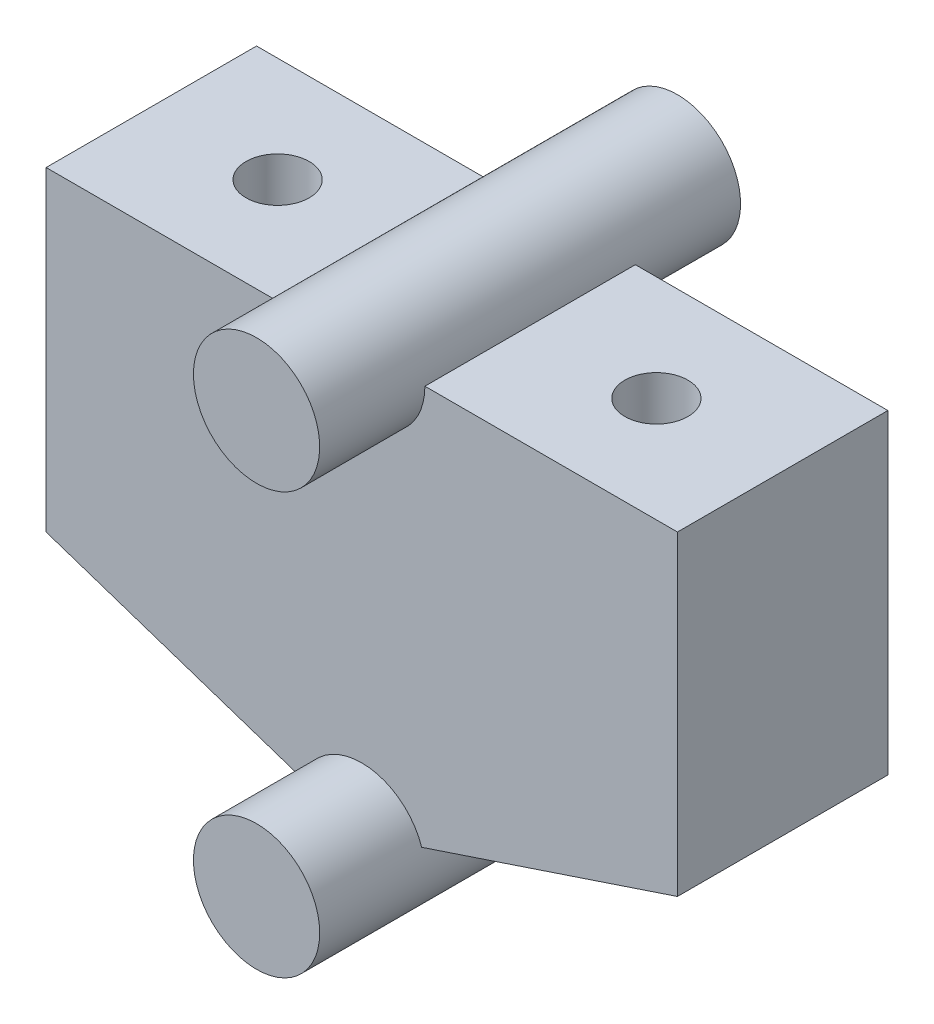
from build123d import *

# Parameters (mm, degrees)
BOSS_EXTRUDE1_DEPTH      = 10
BOSS_EXTRUDE2_DEPTH      = 15
BOSS_EXTRUDE2_DEPTH_BACK = 5
SKETCH2_R                = 1.5
CUT_EXTRUDE1_DEPTH       = 32.288975694
BOSS_EXTRUDE3_DEPTH      = 5
BOSS_EXTRUDE3_DEPTH_BACK = 15
SKETCH3_R                = 3


with BuildPart() as part:
    # Sketch1 → Boss-Extrude1 (new body)
    with BuildSketch(Plane.XY):
        with BuildLine():
            Line((-15, 7.5), (-15, -7.5))
            Line((-15, -7.5), (-2.846049894, -11.551316702))
            ThreePointArc((-2.846049894, -11.551316702), (0, -9.5), (2.846049894, -11.551316702))
            Line((2.846049894, -11.551316702), (15, -7.5))
            Line((15, -7.5), (15, 7.5))
            Line((15, 7.5), (-15, 7.5))
        make_face()
    extrude(amount=BOSS_EXTRUDE1_DEPTH)

    # Sketch1<3> → Boss-Extrude2 (add, two sides: drawn at the far end of the back side and taken through both)
    with BuildSketch(Plane.XY.offset(-BOSS_EXTRUDE2_DEPTH_BACK)):
        with BuildLine():
            ThreePointArc((2.846049894, -11.551316702), (0, -9.5), (-2.846049894, -11.551316702))
            ThreePointArc((-2.846049894, -11.551316702), (-0.480546729, -15.461262373), (3, -12.5))
            ThreePointArc((3, -12.5), (2.961262373, -12.019453271), (2.846049894, -11.551316702))
        make_face()
    extrude(amount=BOSS_EXTRUDE2_DEPTH + BOSS_EXTRUDE2_DEPTH_BACK)

    # Sketch2 → Cut-Extrude1 (cut, through all)
    with BuildSketch(Plane(origin=(0, 7.5, 0), x_dir=(1, 0, 0), z_dir=(0, 1, 0))):
        with Locations((-9, -5)):
            Circle(SKETCH2_R)
        with Locations((9, -5)):
            Circle(SKETCH2_R)
    extrude(amount=-CUT_EXTRUDE1_DEPTH, mode=Mode.SUBTRACT)

    # Sketch3 → Boss-Extrude3 (add, two sides: drawn at the far end of the back side and taken through both)
    with BuildSketch(Plane(origin=(0, 0, 0), x_dir=(-1, 0, 0), z_dir=(0, 0, -1)).offset(-BOSS_EXTRUDE3_DEPTH_BACK)):
        with Locations((0, 7.5)):
            Circle(SKETCH3_R)
    extrude(amount=BOSS_EXTRUDE3_DEPTH + BOSS_EXTRUDE3_DEPTH_BACK)


solid = part.part
